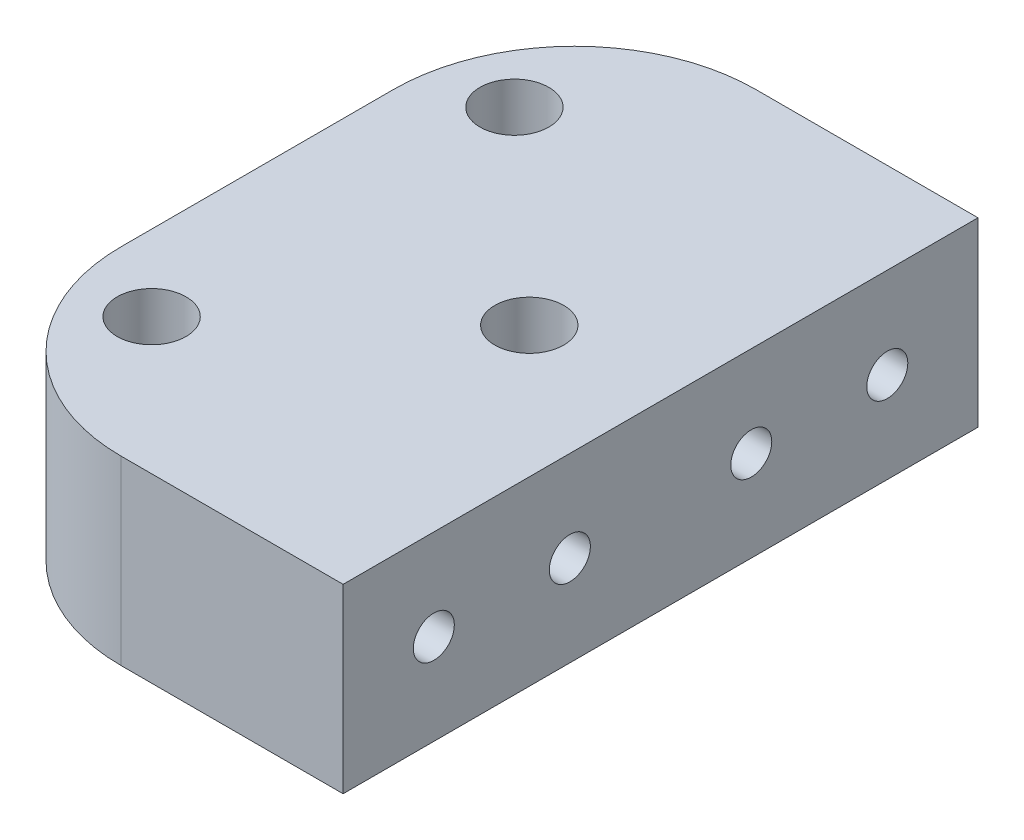
from build123d import *

# Parameters (mm, degrees)
SKETCH1_W                 = 22.2375
SKETCH1_H                 = 35
BOSS_EXTRUDE1_DEPTH       = 10
F_4_40_TAPPED_HOLE1_D     = 2.2606
F_4_40_TAPPED_HOLE1_DEPTH = 7.6
F_4_40_TAPPED_HOLE1_TIP   = 0.679152758
F_6_CLEARANCE_HOLE1_D     = 3.7973
FILLET1_R                 = 10


with BuildPart() as part:
    # Sketch1 → Boss-Extrude1 (new body)
    with BuildSketch(Plane(origin=(0, 0, 0), x_dir=(1, 0, 0), z_dir=(0, 1, 0))):
        Rectangle(SKETCH1_W, SKETCH1_H)
    extrude(amount=BOSS_EXTRUDE1_DEPTH)

    # #4-40 Tapped Hole1
    with Locations(Plane(origin=(11.11875, 0, 0), x_dir=(0, 0, -1), z_dir=(1, 0, 0))):
        with Locations((-12.5, 5), (12.5, 5), (-5, 5), (5, 5)):
            Hole(F_4_40_TAPPED_HOLE1_D / 2, depth=F_4_40_TAPPED_HOLE1_DEPTH)
            with Locations((0, 0, -(F_4_40_TAPPED_HOLE1_DEPTH + F_4_40_TAPPED_HOLE1_TIP / 2))):  # 118° drill point
                Cone(0, F_4_40_TAPPED_HOLE1_D / 2, F_4_40_TAPPED_HOLE1_TIP, mode=Mode.SUBTRACT)

    # #6 Clearance Hole1 (through all)
    with Locations(Plane(origin=(0, 10, 0), x_dir=(1, 0, 0), z_dir=(0, 1, 0))):
        with Locations((3.88125, 0), (-6.93875, 10), (-6.93875, -10)):
            Hole(F_6_CLEARANCE_HOLE1_D / 2)

    # Fillet1
    fillet1_edges = [part.edges().sort_by_distance(p)[0] for p in [
        (-11.11875, 5, 17.5),
        (-11.11875, 5, -17.5),
    ]]
    fillet(fillet1_edges, radius=FILLET1_R)


solid = part.part
